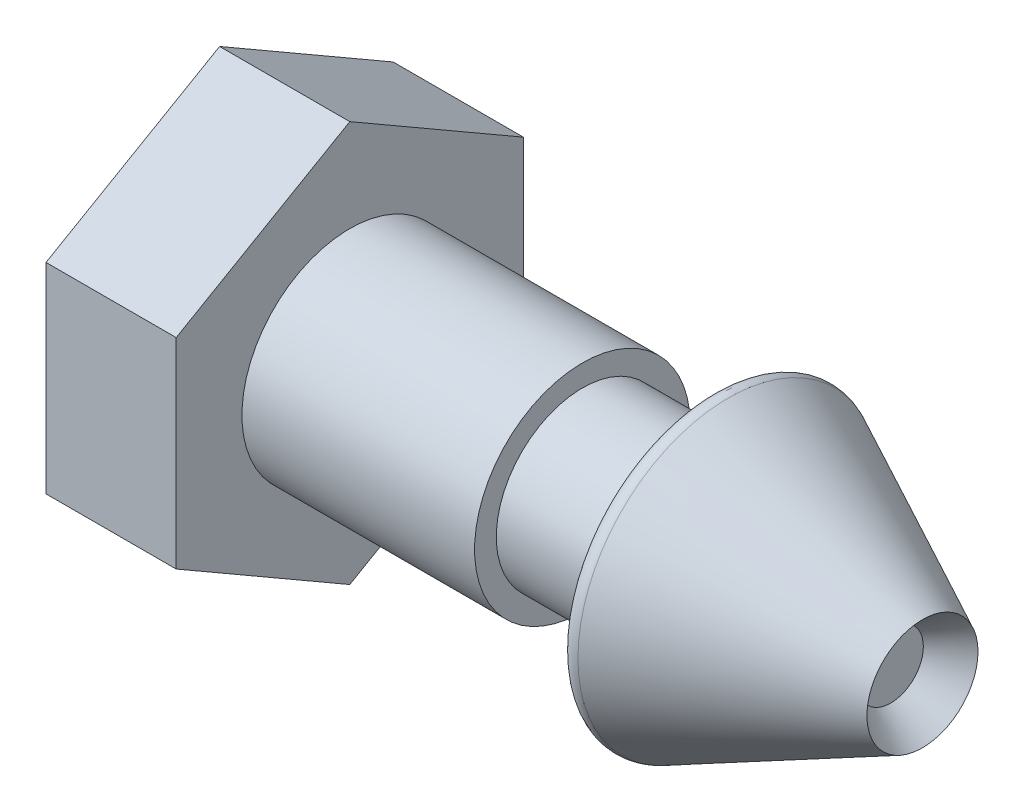
from build123d import *

# Parameters (mm, degrees)
BOSS_EXTRUDE1_DEPTH = 6
FILLET2_R           = 0.5


with BuildPart() as part:
    # Sketch1 → Revolve1 (revolve)
    with BuildSketch(Plane.XY, mode=Mode.PRIVATE) as revolve1_sk:
        Polygon((0, 0), (0, 4.97), (10.72, 4.97), (10.72, 3.97), (16.72, 3.97), (16.72, 7.276374131), (26.39, 2.56), (24.931035164, 1.5), (24.931035164, 0), align=None)
    revolve(revolve1_sk.sketch.rotate(Axis((24.931035164, 0, 0), (-1, 0, 0)), 90), axis=Axis((24.931035164, 0, 0), (-1, 0, 0)))

    # Sketch2 → Boss-Extrude1 (add)
    with BuildSketch(Plane.ZY):
        Polygon((0, 9.237604307), (-8, 4.618802154), (-8, -4.618802154), (0, -9.237604307), (8, -4.618802154), (8, 4.618802154), align=None)
    extrude(amount=BOSS_EXTRUDE1_DEPTH)

    # Fillet2
    fillet2_edges = [part.edges().sort_by_distance(p)[0] for p in [
        (16.72, 0, 7.276374131),
        (16.72, 0, 3.97),
    ]]
    fillet(fillet2_edges, radius=FILLET2_R)


solid = part.part
